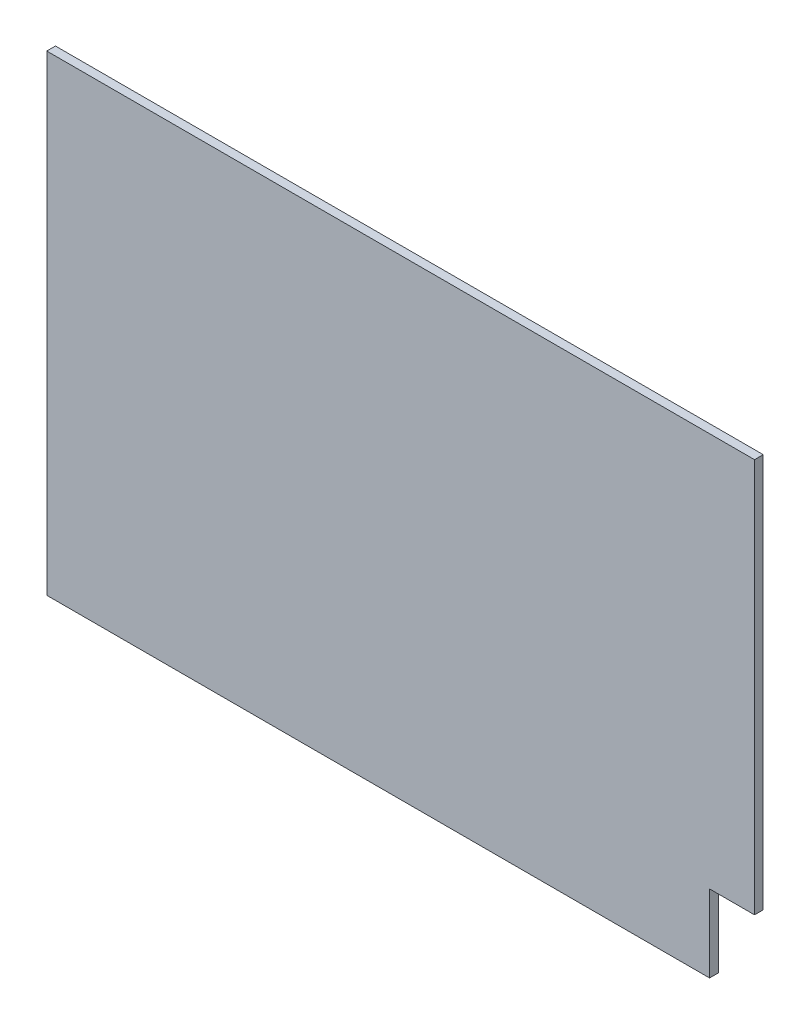
from build123d import *

# Parameters (mm, degrees)
BOSS_EXTRUDE1_DEPTH = 30


with BuildPart() as part:
    # Sketch1 → Boss-Extrude1 (new body)
    with BuildSketch(Plane.XY):
        Polygon((0, 0), (2285, 0), (2285, 266), (2440, 266), (2440, 1625), (0, 1625), align=None)
    extrude(amount=BOSS_EXTRUDE1_DEPTH)


solid = part.part
